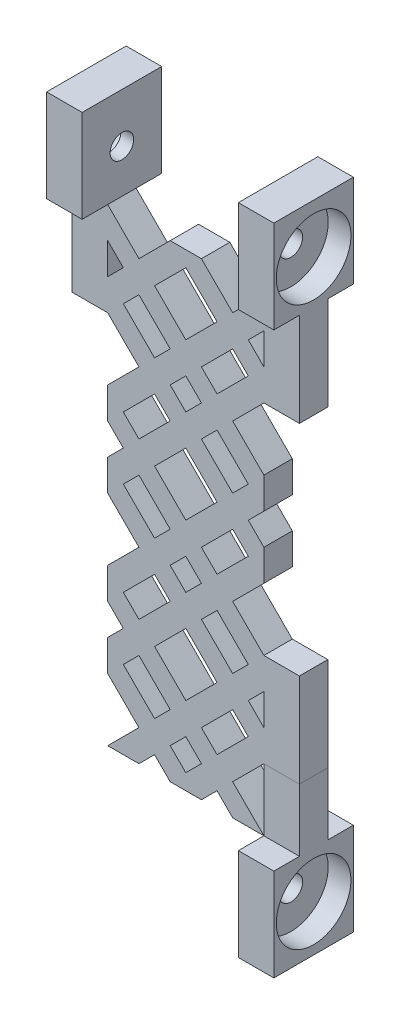
from build123d import *

# Parameters (mm, degrees)
BOSS_EXTRUDE1_DEPTH  = 10
SKETCH3_W            = 10
SKETCH3_H            = 33.000000074
BOSS_EXTRUDE3_DEPTH  = 12.5
SKETCH4_W            = 12.5
SKETCH4_H            = 28
BOSS_EXTRUDE4_DEPTH  = 32.6
SKETCH6_R            = 13.15
CUT_EXTRUDE2_DEPTH   = 8
SKETCH7_R            = 4.15
CUT_EXTRUDE3_DEPTH   = 227.679972726
SKETCH8_W            = 10
SKETCH8_H            = 32.999999987
BOSS_EXTRUDE6_DEPTH  = 12.5
SKETCH9_W            = 12.5
SKETCH9_H            = 10
BOSS_EXTRUDE9_DEPTH  = 22
SKETCH10_W           = 12.5
SKETCH10_H           = 28
BOSS_EXTRUDE10_DEPTH = 32.6
SKETCH12_R           = 13.15
CUT_EXTRUDE4_DEPTH   = 8
SKETCH13_R           = 4.15
CUT_EXTRUDE5_DEPTH   = 8


with BuildPart() as part:
    # Sketch2 → Boss-Extrude1 (new body)
    with BuildSketch(Plane.XY):
        Polygon((-27.500000006, 170.499999994), (-27.500000006, 181.499999994), (-16.500000002, 170.499999998), (-5.499999969, 181.500000031), (5.500000025, 181.500000031), (16.500000011, 170.500000056), (27.500000013, 181.500000073), (27.500000013, 170.500000022), (22.000000007, 165.000000067), (27.500000013, 159.500000067), (27.500000013, 148.499999999), (16.500000017, 137.500000003), (27.500000013, 126.500000014), (27.500000013, 115.499999993), (22.000000001, 109.999999981), (27.500000013, 104.499999969), (27.500000013, 93.499999996), (16.500000007, 82.49999999), (27.500000013, 71.499999999), (27.500000013, 60.500000004), (22.000000008, 54.999999998), (27.500000013, 49.499999999), (27.500000013, 38.500000012), (16.499999997, 27.499999996), (27.5, 16.5), (16.500000019, 16.5), (11.000000008, 22.000000007), (5.500000001, 16.5), (-5.500000011, 16.5), (-11.000000001, 21.99999999), (-16.499999991, 16.5), (-27.5, 16.5), (-16.500000013, 27.500000002), (-27.500000006, 38.499999994), (-27.500000006, 49.499999994), (-22.000000004, 54.999999996), (-27.500000006, 60.499999994), (-27.500000006, 71.499999994), (-16.500000006, 82.500000002), (-27.500000006, 93.499999994), (-27.500000006, 104.499999994), (-22.000000034, 109.999999972), (-27.500000006, 115.499999994), (-27.500000006, 126.49999998), (-16.500000006, 137.499999995), (-27.500000006, 148.499999994), (-27.500000006, 159.499999994), (-22.000000006, 164.999999994), align=None)
        Polygon((21.999999977, 121.000000012), (16.499999976, 115.500000007), (5.499999998, 126.499999984), (11.000000002, 131.999999987), align=None, mode=Mode.SUBTRACT)
        Polygon((-22.000000007, 65.999999973), (-16.500000015, 60.499999985), (-5.499999998, 71.500000002), (-10.99999999, 76.99999999), align=None, mode=Mode.SUBTRACT)
        Polygon((-5.5e-08, 175.999999934), (10.999999921, 164.999999958), (-7e-09, 154.000000015), (-10.999999994, 164.999999995), align=None, mode=Mode.SUBTRACT)
        Polygon((21.999999912, 153.999999967), (10.999999987, 143.000000029), (5.4999999, 148.500000112), (16.499999884, 159.499999995), align=None, mode=Mode.SUBTRACT)
        Polygon((-22.000000014, 98.999999972), (-11.000000021, 87.999999991), (-5.500000115, 93.499999901), (-16.500000049, 104.499999937), align=None, mode=Mode.SUBTRACT)
        Polygon((-22.00000026, 121.000000206), (-16.50000003, 115.499999982), (-5.500000018, 126.500000007), (-11.000000188, 132.000000177), align=None, mode=Mode.SUBTRACT)
        Polygon((21.999999733, 65.999999799), (16.49999997, 60.50000003), (5.500000002, 71.499999986), (10.999999825, 76.999999808), align=None, mode=Mode.SUBTRACT)
        Polygon((-22.000000004, 153.999999986), (-11.000000013, 142.999999995), (-5.500000013, 148.500000002), (-16.5, 159.499999989), align=None, mode=Mode.SUBTRACT)
        Polygon((21.999999994, 98.999999994), (10.999999995, 87.999999995), (5.500000001, 93.499999981), (16.500000004, 104.499999985), align=None, mode=Mode.SUBTRACT)
        Polygon((-21.999999984, 43.999999999), (-11.00000001, 33.000000012), (-5.500000013, 38.500000017), (-16.499999993, 49.49999999), align=None, mode=Mode.SUBTRACT)
        Polygon((22.00000002, 44.000000003), (11.000000003, 32.999999986), (5.499999997, 38.499999988), (16.500000015, 49.500000005), align=None, mode=Mode.SUBTRACT)
        Polygon((10.999999982, 55.000000034), (-2.8e-08, 44.000000009), (-11.000000005, 54.999999978), (1.3e-08, 65.999999996), align=None, mode=Mode.SUBTRACT)
        Polygon((-11.000000013, 109.999999973), (-2.2e-08, 98.999999997), (10.999999981, 110.000000008), (2e-09, 120.999999987), align=None, mode=Mode.SUBTRACT)
        Polygon((-5.499999998, 27.499999993), (3e-09, 21.999999986), (5.500000014, 27.499999998), (9e-09, 32.999999999), align=None, mode=Mode.SUBTRACT)
        Polygon((5.499999842, 82.499999842), (-9e-09, 76.999999991), (-5.500000002, 82.499999978), (-1.23e-07, 87.999999858), align=None, mode=Mode.SUBTRACT)
        Polygon((-5.500000166, 137.500000148), (-2.4e-08, 132.000000006), (5.499999976, 137.500000013), (-1.37e-07, 143.000000126), align=None, mode=Mode.SUBTRACT)
    extrude(amount=BOSS_EXTRUDE1_DEPTH)

    # Sketch3 → Boss-Extrude3 (add)
    with BuildSketch(Plane(origin=(27.500000013, 0, 0), x_dir=(0, 0, -1), z_dir=(1, 0, 0))):
        with Locations((-5, 165.000000036)):
            Rectangle(SKETCH3_W, SKETCH3_H)
    boss_extrude3 = extrude(amount=BOSS_EXTRUDE3_DEPTH)

    # Mirror1: Boss-Extrude3 across plane
    add(boss_extrude3.mirror(Plane(origin=(0, 0, 0), x_dir=(0, 0, 1), z_dir=(1, 0, 0))))

    # Sketch4 → Boss-Extrude4 (add)
    with BuildSketch(Plane(origin=(0, 181.500000073, 0), x_dir=(1, 0, 0), z_dir=(0, 1, 0))):
        with Locations((33.750000013, -5)):
            Rectangle(SKETCH4_W, SKETCH4_H)
    boss_extrude4 = extrude(amount=BOSS_EXTRUDE4_DEPTH)

    # Mirror2: Boss-Extrude4 across plane
    add(boss_extrude4.mirror(Plane(origin=(0, 0, 0), x_dir=(0, 0, 1), z_dir=(1, 0, 0))))

    # Sketch6 → Cut-Extrude2 (cut)
    with BuildSketch(Plane.ZY.offset(40.000000013)):
        with Locations((5, 196.800000073)):
            Circle(SKETCH6_R)
    cut_extrude2 = extrude(amount=-CUT_EXTRUDE2_DEPTH, mode=Mode.SUBTRACT)

    # Mirror3: Cut-Extrude2 across plane
    add(cut_extrude2.mirror(Plane(origin=(0, 0, 0), x_dir=(0, 0, 1), z_dir=(1, 0, 0))), mode=Mode.SUBTRACT)

    # Sketch7 → Cut-Extrude3 (cut, through all)
    with BuildSketch(Plane.ZY.offset(32.000000013)):
        with Locations((5, 196.800000073)):
            Circle(SKETCH7_R)
    extrude(amount=-CUT_EXTRUDE3_DEPTH, mode=Mode.SUBTRACT)

    # Sketch8 → Boss-Extrude6 (add)
    with BuildSketch(Plane(origin=(27.500000013, 0, 0), x_dir=(0, 0, -1), z_dir=(1, 0, 0))):
        with Locations((-5, 55.000000006)):
            Rectangle(SKETCH8_W, SKETCH8_H)
    extrude(amount=BOSS_EXTRUDE6_DEPTH)


with BuildPart() as body_2:
    # Sketch9 → Boss-Extrude9 (new body)
    with BuildSketch(Plane.XZ.offset(-38.500000012)):
        with Locations((33.750000013, 5)):
            Rectangle(SKETCH9_W, SKETCH9_H)
    extrude(amount=BOSS_EXTRUDE9_DEPTH)

    # Sketch10 → Boss-Extrude10 (add)
    with BuildSketch(Plane.XZ.offset(-16.500000012)):
        with Locations((33.750000013, 5)):
            Rectangle(SKETCH10_W, SKETCH10_H)
    extrude(amount=BOSS_EXTRUDE10_DEPTH)

    # Sketch12 → Cut-Extrude4 (cut)
    with BuildSketch(Plane(origin=(40.000000013, 0, 0), x_dir=(0, 0, -1), z_dir=(1, 0, 0))):
        with Locations((-5, 0.200000012)):
            Circle(SKETCH12_R)
    extrude(amount=-CUT_EXTRUDE4_DEPTH, mode=Mode.SUBTRACT)

    # Sketch13 → Cut-Extrude5 (cut)
    with BuildSketch(Plane(origin=(32.000000013, 0, 0), x_dir=(0, 0, -1), z_dir=(1, 0, 0))):
        with Locations((-5, 0.200000012)):
            Circle(SKETCH13_R)
    extrude(amount=-CUT_EXTRUDE5_DEPTH, mode=Mode.SUBTRACT)


solid = Compound([part.part, body_2.part])
